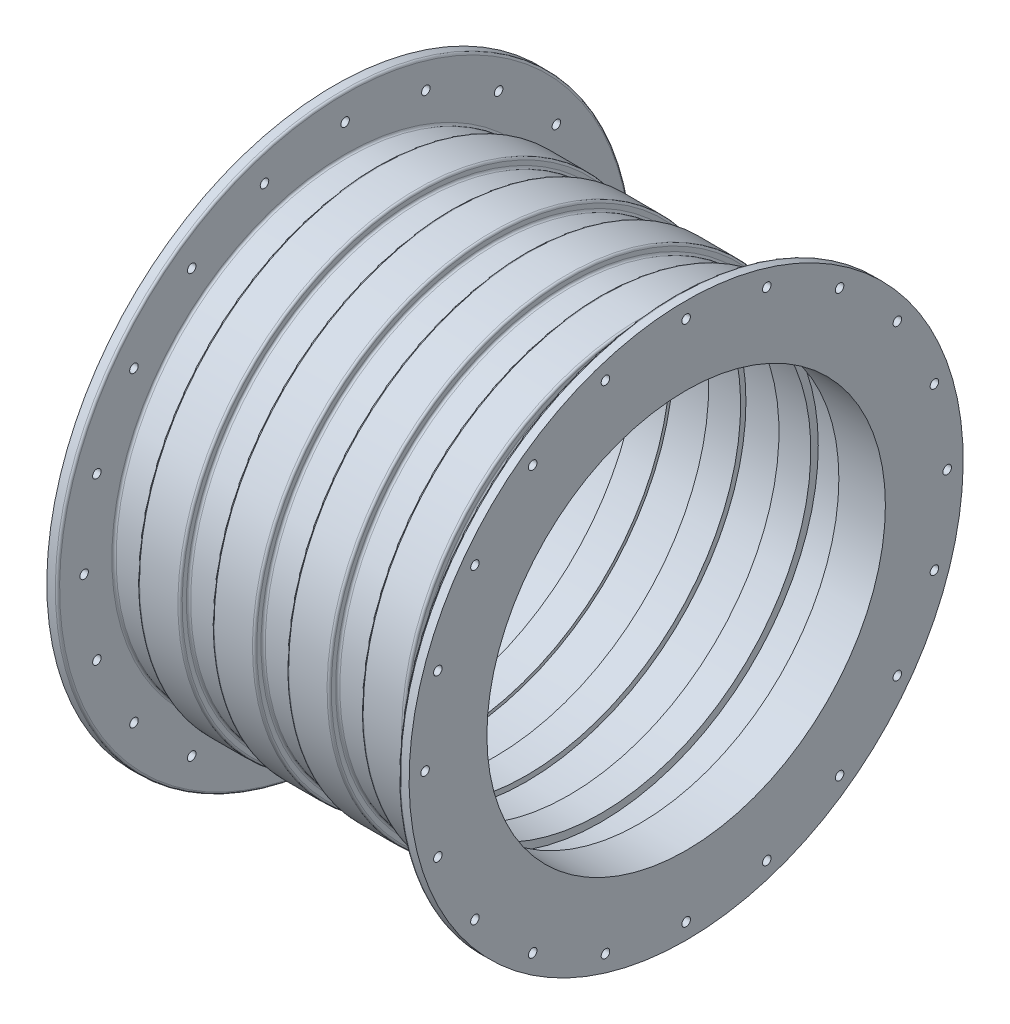
from build123d import *

# Parameters (mm, degrees)
SKETCH2_R          = 2
CUT_EXTRUDE1_DEPTH = 10
CUT_EXTRUDE2_START = -10
SKETCH3_R          = 2
CUT_EXTRUDE2_DEPTH = 10
CIRPATTERN1_COUNT  = 20
FILLET1_R          = 1


with BuildPart() as part:
    # Sketch1 → Revolve1 (revolve)
    with BuildSketch(Plane.XY, mode=Mode.PRIVATE) as revolve1_sk:
        Polygon((75.5, 130), (70.5, 130), (70.5, 108.5), (55.5, 108.5), (55.5, 112.5), (35.5, 112.5), (35.5, 108.5), (20.5, 108.5), (20.5, 112.5), (0.5, 112.5), (0.5, 108.5), (-14.5, 108.5), (-14.5, 112.5), (-34.5, 112.5), (-34.5, 108.5), (-49.5, 108.5), (-49.5, 112.5), (-69.5, 112.5), (-69.5, 108.5), (-84.5, 108.5), (-84.5, 135), (-89.5, 135), (-89.5, 101.5), (-69.5, 101.5), (-69.5, 105), (-49.435625128, 105), (-49.435625128, 102.5), (-34.435625128, 102.5), (-34.435625128, 104), (-14.435625128, 104), (-14.435625128, 100.5), (0.564374872, 100.5), (0.564374872, 103), (20.564374872, 103), (20.564374872, 98.5), (35.5, 98.5), (35.5, 102), (53.668241863, 102), (53.668241863, 93.5), (75.5, 93.5), align=None)
    revolve(revolve1_sk.sketch.rotate(Axis((-34.090909091, 0, 0), (1, 0, 0)), 180), axis=Axis((-34.090909091, 0, 0), (1, 0, 0)))

    # Sketch2 → Cut-Extrude1 (cut)
    with BuildSketch(Plane.ZY.offset(89.5)):
        with Locations(Location((0, 122.5, 0), (0, 0, 270))):
            Circle(SKETCH2_R)
    cut_extrude1 = extrude(amount=-CUT_EXTRUDE1_DEPTH, mode=Mode.SUBTRACT)

    # Sketch3 → Cut-Extrude2 (cut)
    with BuildSketch(Plane(origin=(75.5, 0, 0), x_dir=(0, 0, -1), z_dir=(1, 0, 0)).offset(CUT_EXTRUDE2_START)):
        with Locations(Location((0, 122.5, 0), (0, 0, 270))):
            Circle(SKETCH3_R)
    cut_extrude2 = extrude(amount=CUT_EXTRUDE2_DEPTH, mode=Mode.SUBTRACT)

    # CirPattern1: Cut-Extrude1, Cut-Extrude2 ×20 about axis
    cirpattern1_axis = Axis((0, 0, 0), (1, 0, 0))
    add([cut_extrude1.rotate(cirpattern1_axis, i * 360 / CIRPATTERN1_COUNT) for i in range(1, CIRPATTERN1_COUNT)], mode=Mode.SUBTRACT)
    add([cut_extrude2.rotate(cirpattern1_axis, i * 360 / CIRPATTERN1_COUNT) for i in range(1, CIRPATTERN1_COUNT)], mode=Mode.SUBTRACT)

    # Fillet1
    fillet1_edges = [part.edges().sort_by_distance(p)[0] for p in [
        (-84.5, 135, 0),
        (-84.5, 108.5, 0),
        (-69.5, 112.5, 0),
        (-49.5, 112.5, 0),
        (-49.5, 108.5, 0),
        (-34.5, 108.5, 0),
        (-34.5, 112.5, 0),
        (-14.5, 112.5, 0),
        (-14.5, 108.5, 0),
        (0.5, 108.5, 0),
        (0.5, 112.5, 0),
        (20.5, 112.5, 0),
        (20.5, 108.5, 0),
        (35.5, 108.5, 0),
        (35.5, 112.5, 0),
        (55.5, 112.5, 0),
        (55.5, 108.5, 0),
        (70.5, 108.5, 0),
        (70.5, 130, 0),
    ]]
    fillet(fillet1_edges, radius=FILLET1_R)


solid = part.part
